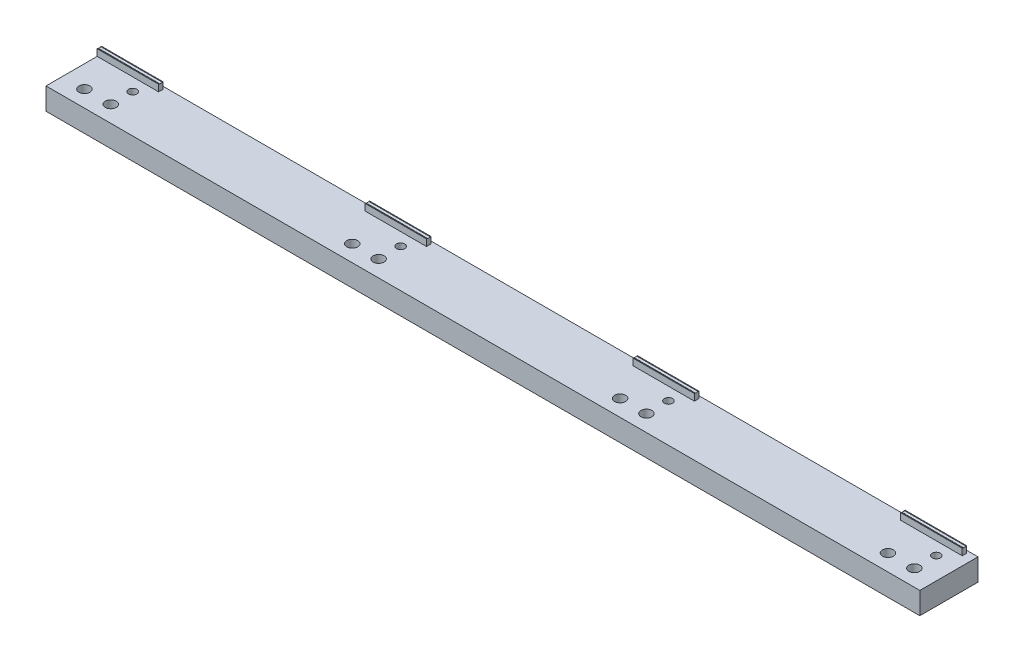
from build123d import *

# Parameters (mm, degrees)
SKETCH2_W           = 796
SKETCH2_H           = 53
BOSS_EXTRUDE1_DEPTH = 20
SKETCH2_3_R         = 5
SKETCH2_3_R_2       = 3.75
CUT_EXTRUDE1_DEPTH  = 799.013157786
BOSS_EXTRUDE2_START = -8
BOSS_EXTRUDE2_DEPTH = 56
LPATTERN1_COUNT     = 4
LPATTERN1_PITCH     = 244


with BuildPart() as part:
    # Sketch2 → Boss-Extrude1 (new body)
    with BuildSketch(Plane(origin=(0, 0, 0), x_dir=(1, 0, 0), z_dir=(0, 1, 0))):
        with Locations((398, 26.5)):
            Rectangle(SKETCH2_W, SKETCH2_H)
    extrude(amount=BOSS_EXTRUDE1_DEPTH)

    # Sketch2<3> → Cut-Extrude1 (cut, symmetric)
    with BuildSketch(Plane(origin=(0, 0, 0), x_dir=(1, 0, 0), z_dir=(0, 1, 0))):
        with Locations((752, 15)):
            Circle(SKETCH2_3_R)
        with Locations((776, 35)):
            Circle(SKETCH2_3_R_2)
        with Locations((776, 15)):
            Circle(SKETCH2_3_R)
    cut_extrude1 = extrude(amount=CUT_EXTRUDE1_DEPTH, both=True, mode=Mode.SUBTRACT)

    # Sketch3 → Boss-Extrude2 (add)
    with BuildSketch(Plane(origin=(796, 0, 0), x_dir=(0, 0, -1), z_dir=(1, 0, 0)).offset(BOSS_EXTRUDE2_START)):
        with BuildLine():
            Line((50.625, 20), (46.625, 20))
            Line((46.625, 20), (46.625, 26))
            Line((46.625, 26), (47.344131154, 26))
            ThreePointArc((47.344131154, 26), (48.625, 25.625), (49.905868846, 26))
            Line((49.905868846, 26), (50.625, 26))
            Line((50.625, 26), (50.625, 20))
        make_face()
    boss_extrude2 = extrude(amount=-BOSS_EXTRUDE2_DEPTH)

    # LPattern1: Cut-Extrude1, Boss-Extrude2 ×4
    with Locations(*[(-i * LPATTERN1_PITCH, 0, 0) for i in range(1, LPATTERN1_COUNT)]):
        add(cut_extrude1, mode=Mode.SUBTRACT)
        add(boss_extrude2)


solid = part.part
